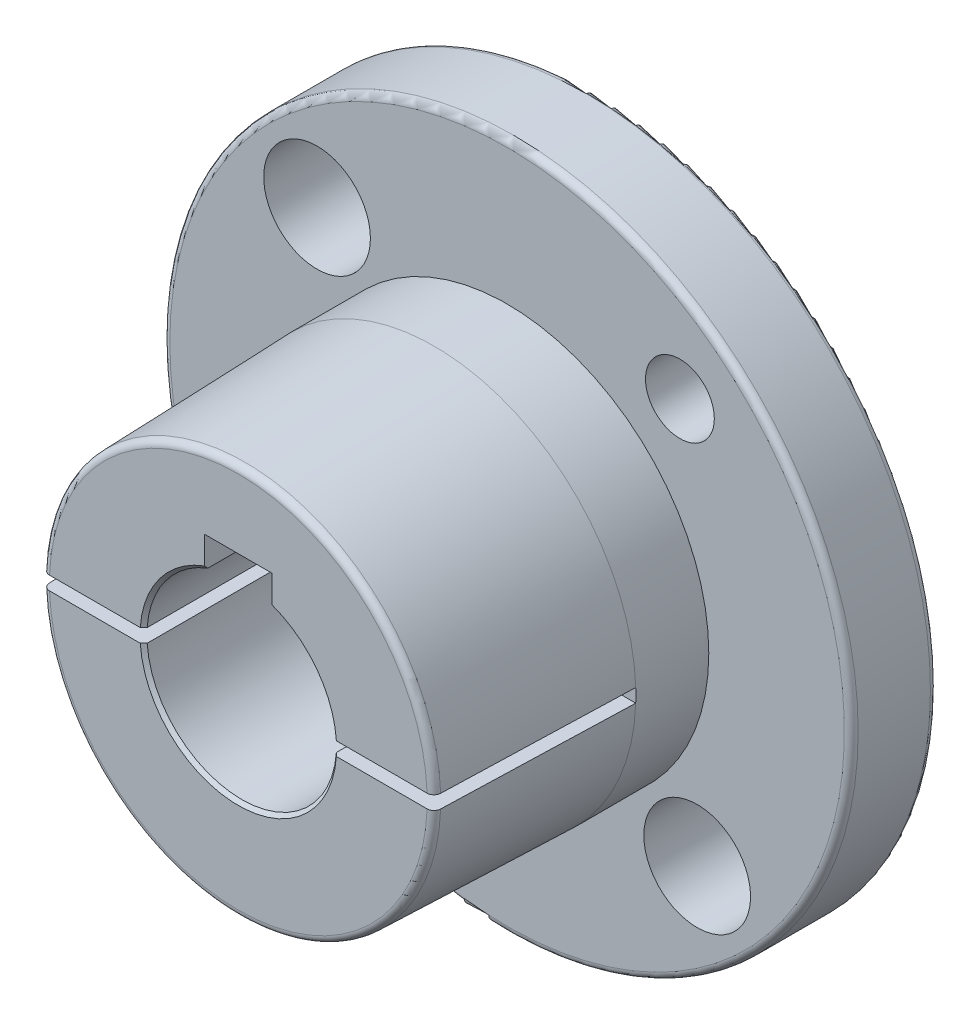
from build123d import *

# Parameters (mm, degrees)
FILLET1_R                        = 0.508
FILLET2_R                        = 0.508
CHAMFER1_SIZE                    = 0.254
SKETCH19_R                       = 2.54
THREADED_HOLES_1_DEPTH           = 42.03464937
SKETCH22_R                       = 3.937
CLEARANCE_HOLES_DEPTH            = 42.03464937
CLEARANCE_HOLES_CIRPATTERN_COUNT = 2
SKETCH23_W                       = 5
SKETCH23_H                       = 2.3
CUT_EXTRUDE1_DEPTH               = 45.453345531
CUT_EXTRUDE2_START               = -14.4526
SKETCH24_W                       = 29.7688
SKETCH24_H                       = 1
CUT_EXTRUDE2_DEPTH               = 14.4526


with BuildPart() as part:
    # Sketch1 → Revolve1 (revolve)
    with BuildSketch(Plane(origin=(0, 0, 0), x_dir=(0, 0, -1), z_dir=(1, 0, 0)), mode=Mode.PRIVATE) as revolve1_sk:
        Polygon((-13.0937, 7), (-13.0937, 14.432756404), (1.3589, 14.8844), (6.7437, 14.8844), (6.7437, 25.4), (13.0937, 25.4), (13.0937, 7), align=None)
    revolve(revolve1_sk.sketch.rotate(Axis((0, 0, 13.0937), (0, 0, -1)), 90), axis=Axis((0, 0, 13.0937), (0, 0, -1)))

    # Fillet1
    fillet1_edges = [part.edges().sort_by_distance(p)[0] for p in [
        (-25.4, 0, -13.0937),
        (-25.4, 0, -6.7437),
    ]]
    fillet(fillet1_edges, radius=FILLET1_R)

    # Fillet2
    fillet2_edges = [part.edges().sort_by_distance(p)[0] for p in [
        (-14.432756404, 0, 13.0937),
    ]]
    fillet(fillet2_edges, radius=FILLET2_R)

    # Chamfer1
    chamfer1_edges = [part.edges().sort_by_distance(p)[0] for p in [
        (-7, 0, -13.0937),
        (-7, 0, 13.0937),
    ]]
    chamfer(chamfer1_edges, length=CHAMFER1_SIZE)

    # Sketch19 → Threaded holes 1 (cut, through all)
    with BuildSketch(Plane.XY.offset(-6.7437)):
        with Locations((12.751234928, 15.196330036)):
            Circle(SKETCH19_R)
        with Locations((-12.751234928, -15.196330036)):
            Circle(SKETCH19_R)
    extrude(amount=-THREADED_HOLES_1_DEPTH, mode=Mode.SUBTRACT)

    # Sketch22 → Clearance holes (cut, through all)
    with BuildSketch(Plane.XY.offset(-6.7437)):
        with Locations((-14.027160061, 14.027160061)):
            Circle(SKETCH22_R)
    clearance_holes = extrude(amount=-CLEARANCE_HOLES_DEPTH, mode=Mode.SUBTRACT)

    # Clearance holes CirPattern: Clearance holes ×2 about axis
    clearance_holes_cirpattern_axis = Axis((0, 0, 0), (0, 0, 1))
    for i in range(1, CLEARANCE_HOLES_CIRPATTERN_COUNT):
        add(clearance_holes.rotate(clearance_holes_cirpattern_axis, i * 360 / CLEARANCE_HOLES_CIRPATTERN_COUNT), mode=Mode.SUBTRACT)

    # Sketch23 → Cut-Extrude1 (cut, through all)
    with BuildSketch(Plane.XY.offset(13.0937)):
        with Locations((0, 7.688348415)):
            Rectangle(SKETCH23_W, SKETCH23_H)
    extrude(amount=-CUT_EXTRUDE1_DEPTH, mode=Mode.SUBTRACT)

    # Sketch24 → Cut-Extrude2 (cut)
    with BuildSketch(Plane.XY.offset(13.0937).offset(CUT_EXTRUDE2_START)):
        Rectangle(SKETCH24_W, SKETCH24_H)
    extrude(amount=CUT_EXTRUDE2_DEPTH, mode=Mode.SUBTRACT)


solid = part.part
